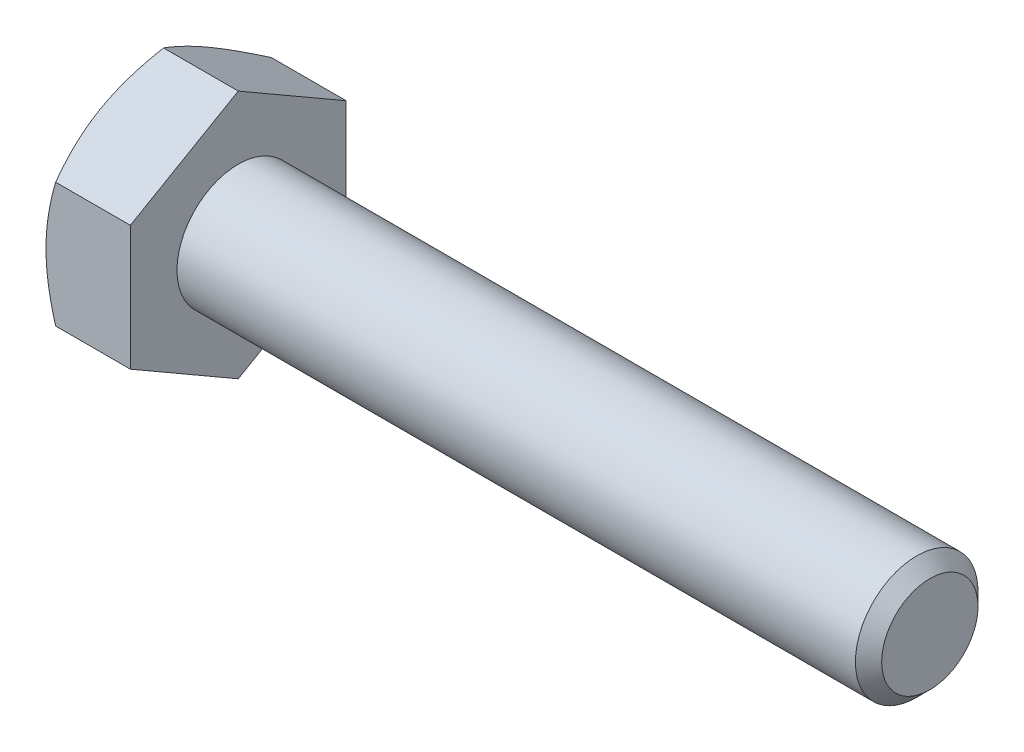
from build123d import *

# Parameters (mm, degrees)
SKETCH5_R           = 3.175
BOSS_EXTRUDE3_DEPTH = 35.814
CHAMFER1_SIZE       = 0.680357143
BOSS_EXTRUDE4_DEPTH = 4.3688
SKETCH8_OUTSIDE_W   = 167.676
SKETCH8_OUTSIDE_H   = 169.404
SKETCH8_OUTSIDE_R   = 5.588
CUT_EXTRUDE3_DEPTH  = 42.079404635
CUT_EXTRUDE3_DRAFT  = -60


with BuildPart() as part:
    # Sketch5 → Boss-Extrude3 (new body)
    with BuildSketch(Plane(origin=(20.0914, 0, 0), x_dir=(0, 0, -1), z_dir=(1, 0, 0))):
        Circle(SKETCH5_R)
    extrude(amount=-BOSS_EXTRUDE3_DEPTH)

    # Chamfer1
    chamfer1_edges = [part.edges().sort_by_distance(p)[0] for p in [
        (20.0914, 0, 3.175),
    ]]
    chamfer(chamfer1_edges, length=CHAMFER1_SIZE)

    # Sketch6 → Boss-Extrude4 (add)
    with BuildSketch(Plane.ZY.offset(15.7226)):
        Polygon((5.588, 3.226233304), (0, 6.452466608), (-5.588, 3.226233304), (-5.588, -3.226233304), (0, -6.452466608), (5.588, -3.226233304), align=None)
    extrude(amount=BOSS_EXTRUDE4_DEPTH)


with BuildPart() as cut_extrude3_tool:
    # Sketch8 outside → Cut-Extrude3 (with draft: the straight prism first)
    with BuildSketch(Plane.ZY.offset(20.0914)):
        Rectangle(SKETCH8_OUTSIDE_W, SKETCH8_OUTSIDE_H)
        Circle(SKETCH8_OUTSIDE_R, mode=Mode.SUBTRACT)
    extrude(amount=-CUT_EXTRUDE3_DEPTH)
    # Cut-Extrude3: the draft: its side faces are tilted about the plane it starts from
    cut_extrude3_sides = [cut_extrude3_tool.faces().sort_by_distance(p)[0] for p in [
        (0.948302318, -84.702, 0),
        (0.948302318, 0, 83.838),
        (0.948302318, 84.702, 0),
        (0.948302318, 0, -83.838),
        (0.948302318, 0, -5.588),
    ]]
    draft(cut_extrude3_sides, Plane.ZY.offset(20.0914), CUT_EXTRUDE3_DRAFT)


with BuildPart() as part_1:
    add(part.part)

    # Cut-Extrude3: cut by cut_extrude3_tool
    add(cut_extrude3_tool.part, mode=Mode.SUBTRACT)


solid = part_1.part
